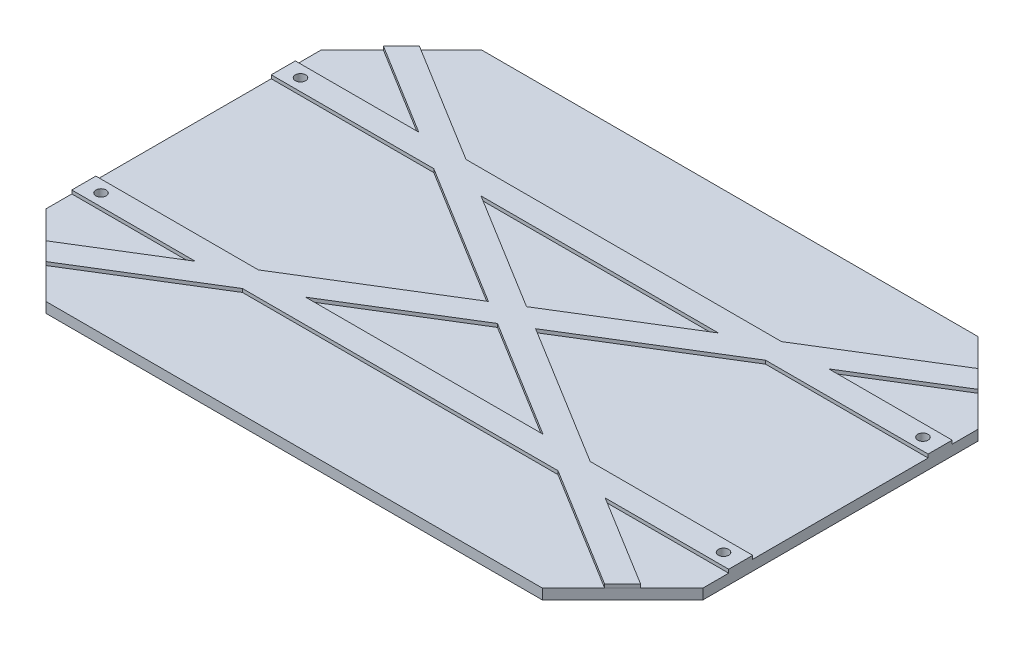
from build123d import *

# Parameters (mm, degrees)
SALIENTE_EXTRUIR1_DEPTH = 3
SALIENTE_EXTRUIR2_DEPTH = 1
CROQUIS3_R              = 1.5
CORTAR_EXTRUIR1_DEPTH   = 115.662203643
CROQUIS5_R              = 1.5
CORTAR_EXTRUIR2_DEPTH   = 115.662203643


with BuildPart() as part:
    # Croquis1 → Saliente-Extruir1 (new body)
    with BuildSketch(Plane(origin=(0, 0, 0), x_dir=(1, 0, 0), z_dir=(0, 1, 0))):
        Polygon((-72.165, -63.334523779), (72.165, -63.334523779), (95.499523779, -40), (95.499523779, 40), (72.165, 63.334523779), (-72.165, 63.334523779), (-95.499523779, 40), (-95.499523779, -40), align=None)
    extrude(amount=SALIENTE_EXTRUIR1_DEPTH)

    # Croquis2 → Saliente-Extruir2 (add)
    with BuildSketch(Plane(origin=(0, 3, 0), x_dir=(1, 0, 0), z_dir=(0, 1, 0))):
        Polygon((-95.499523779, -25.5), (-95.499523779, -32.5), (-59.599057268, -32.5), (-86.448609178, -49.046390822), (-81.218176491, -54.281347289), (-45.874561104, -32.5), (45.875356635, -32.5), (81.215914601, -54.279085399), (86.450579917, -49.048363047), (59.59824255, -32.5), (95.499523779, -32.5), (95.499523779, -25.5), (48.239634992, -25.5), (6.861850317, 0), (48.239634992, 25.5), (95.499523779, 25.5), (95.499523779, 32.5), (59.59824255, 32.5), (86.450579917, 49.048363047), (81.215914601, 54.279085399), (45.875356635, 32.5), (-45.874561104, 32.5), (-81.218176491, 54.281347289), (-86.448609178, 49.046390822), (-59.599057268, 32.5), (-95.499523779, 32.5), (-95.499523779, 25.5), (-48.240274232, 25.5), (-6.861850317, 0), (-48.240274232, -25.5), align=None)
        Polygon((34.516573599, -25.5), (-34.515975042, -25.5), (0, -4.228705845), align=None, mode=Mode.SUBTRACT)
        Polygon((0, 4.228705845), (-34.515975042, 25.5), (34.516573599, 25.5), align=None, mode=Mode.SUBTRACT)
    extrude(amount=SALIENTE_EXTRUIR2_DEPTH)

    # Croquis3 → Cortar-Extruir1 (cut, through all)
    with BuildSketch(Plane(origin=(0, 4, 0), x_dir=(1, 0, 0), z_dir=(0, 1, 0))):
        with Locations(Location((-90.499523779, -29, 0), (0, 0, 270))):
            Circle(CROQUIS3_R)
    extrude(amount=-CORTAR_EXTRUIR1_DEPTH, mode=Mode.SUBTRACT)

    # Croquis5 → Cortar-Extruir2 (cut, through all)
    with BuildSketch(Plane(origin=(0, 4, 0), x_dir=(1, 0, 0), z_dir=(0, 1, 0))):
        with Locations(Location((-90.499523779, 29, 0), (0, 0, 270))):
            Circle(CROQUIS5_R)
        with Locations(Location((90.499523779, 29, 0), (0, 0, 270))):
            Circle(CROQUIS5_R)
        with Locations(Location((90.499523779, -29, 0), (0, 0, 270))):
            Circle(CROQUIS5_R)
    extrude(amount=-CORTAR_EXTRUIR2_DEPTH, mode=Mode.SUBTRACT)


solid = part.part
